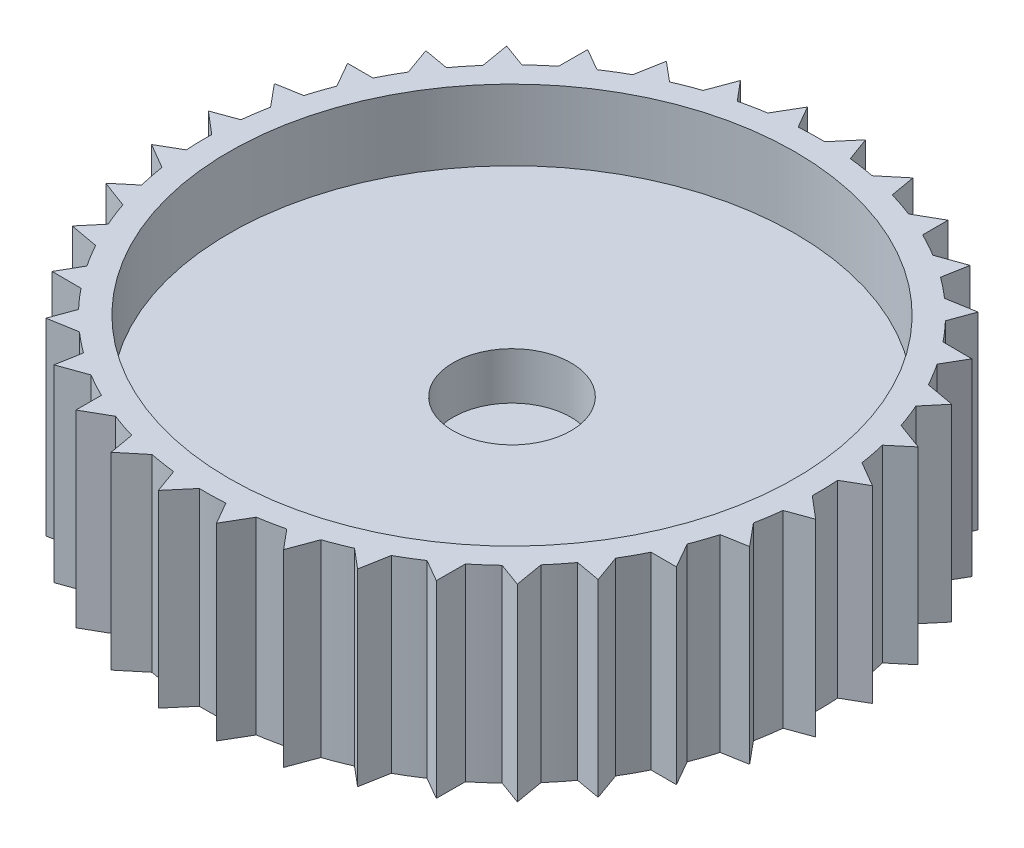
from build123d import *

# Parameters (mm, degrees)
SKETCH_1_R          = 13
EXTRUDE_1_DEPTH     = 8
SKETCH_2_R          = 12
CUT_EXTRUDE_1_DEPTH = 3
EXTRUDE_2_DEPTH     = 8
SKETCH_4_R          = 2.5
CUT_EXTRUDE_2_DEPTH = 2


with BuildPart() as part:
    # 草图1 → 凸台-拉伸1 (new body)
    with BuildSketch(Plane(origin=(0, 0, 0), x_dir=(1, 0, 0), z_dir=(0, 1, 0))):
        with Locations(Location((0, 0, 0), (0, 0, 270))):
            Circle(SKETCH_1_R)
    extrude(amount=EXTRUDE_1_DEPTH)

    # 草图2 → 切除-拉伸1 (cut)
    with BuildSketch(Plane(origin=(0, 8, 0), x_dir=(1, 0, 0), z_dir=(0, 1, 0))):
        with Locations(Location((0, 0, 0), (0, 0, 270))):
            Circle(SKETCH_2_R)
    extrude(amount=-CUT_EXTRUDE_1_DEPTH, mode=Mode.SUBTRACT)

    # 草图3 → 凸台-拉伸2 (add, through all)
    with BuildSketch(Plane(origin=(0, 8, 0), x_dir=(1, 0, 0), z_dir=(0, 1, 0))):
        Polygon((-12.123665589, 4.692199131), (-11.044603538, 4.692199131), (-11.653830585, 5.760922904), (-12.732892635, 5.760922904), align=None)
        Polygon((-11.124688039, 6.726166519), (-10.062019365, 6.53878936), (-10.476408948, 7.697067984), (-11.539077622, 7.884445143), align=None)
        Polygon((-9.787692472, 8.555762741), (-8.773705825, 8.186701784), (-8.980666927, 9.399341549), (-9.994653573, 9.768402506), align=None)
        Polygon((-8.153302822, 10.125396442), (-7.218807673, 9.585865416), (-7.212051886, 10.816020876), (-8.146547034, 11.355551902), align=None)
        Polygon((-6.271179191, 11.387375095), (-5.444569703, 10.693767379), (-5.224302297, 11.904060883), (-6.050911785, 12.597668599), align=None)
        Polygon((-4.198508954, 12.303354118), (-3.504901238, 11.47674463), (-3.077814927, 12.630402023), (-3.771422644, 13.457011511), align=None)
        Polygon((-1.998269147, 12.845501953), (-1.458738122, 11.911006804), (-0.837809708, 12.97297479), (-1.377340734, 13.907469938), align=None)
        Polygon((0.262687056, 12.99734571), (0.631748014, 11.983359064), (1.427651935, 12.921370282), (1.058590978, 13.935356928), align=None)
        Polygon((2.515661647, 12.754271695), (2.703038805, 11.691603022), (3.649735097, 12.477156476), (3.462357938, 13.53982515), align=None)
        Polygon((4.692199131, 12.123665589), (4.692199131, 11.044603538), (5.760922904, 11.653830585), (5.760922904, 12.732892635), align=None)
        Polygon((6.726166519, 11.124688039), (6.53878936, 10.062019365), (7.697067984, 10.476408948), (7.884445143, 11.539077622), align=None)
        Polygon((8.555762741, 9.787692472), (8.186701784, 8.773705825), (9.399341549, 8.980666927), (9.768402506, 9.994653573), align=None)
        Polygon((10.125396442, 8.153302822), (9.585865416, 7.218807673), (10.816020876, 7.212051886), (11.355551902, 8.146547034), align=None)
        Polygon((11.387375095, 6.271179191), (10.693767379, 5.444569703), (11.904060883, 5.224302297), (12.597668599, 6.050911785), align=None)
        Polygon((12.303354118, 4.198508954), (11.47674463, 3.504901238), (12.630402023, 3.077814927), (13.457011511, 3.771422644), align=None)
        Polygon((12.845501953, 1.998269147), (11.911006804, 1.458738122), (12.97297479, 0.837809708), (13.907469938, 1.377340734), align=None)
        Polygon((12.99734571, -0.262687056), (11.983359064, -0.631748014), (12.921370282, -1.427651935), (13.935356928, -1.058590978), align=None)
        Polygon((12.754271695, -2.515661647), (11.691603022, -2.703038805), (12.477156476, -3.649735097), (13.53982515, -3.462357938), align=None)
        Polygon((12.123665589, -4.692199131), (11.044603538, -4.692199131), (11.653830585, -5.760922904), (12.732892635, -5.760922904), align=None)
        Polygon((11.124688039, -6.726166519), (10.062019365, -6.53878936), (10.476408948, -7.697067984), (11.539077622, -7.884445143), align=None)
        Polygon((9.787692472, -8.555762741), (8.773705825, -8.186701784), (8.980666927, -9.399341549), (9.994653573, -9.768402506), align=None)
        Polygon((8.153302822, -10.125396442), (7.218807673, -9.585865416), (7.212051886, -10.816020876), (8.146547034, -11.355551902), align=None)
        Polygon((6.271179191, -11.387375095), (5.444569703, -10.693767379), (5.224302297, -11.904060883), (6.050911785, -12.597668599), align=None)
        Polygon((4.198508954, -12.303354118), (3.504901238, -11.47674463), (3.077814927, -12.630402023), (3.771422644, -13.457011511), align=None)
        Polygon((1.998269147, -12.845501953), (1.458738122, -11.911006804), (0.837809708, -12.97297479), (1.377340734, -13.907469938), align=None)
        Polygon((-0.262687056, -12.99734571), (-0.631748014, -11.983359064), (-1.427651935, -12.921370282), (-1.058590978, -13.935356928), align=None)
        Polygon((-2.515661647, -12.754271695), (-2.703038805, -11.691603022), (-3.649735097, -12.477156476), (-3.462357938, -13.53982515), align=None)
        Polygon((-4.692199131, -12.123665589), (-4.692199131, -11.044603538), (-5.760922904, -11.653830585), (-5.760922904, -12.732892635), align=None)
        Polygon((-6.726166519, -11.124688039), (-6.53878936, -10.062019365), (-7.697067984, -10.476408948), (-7.884445143, -11.539077622), align=None)
        Polygon((-8.555762741, -9.787692472), (-8.186701784, -8.773705825), (-9.399341549, -8.980666927), (-9.768402506, -9.994653573), align=None)
        Polygon((-10.125396442, -8.153302822), (-9.585865416, -7.218807673), (-10.816020876, -7.212051886), (-11.355551902, -8.146547034), align=None)
        Polygon((-11.387375095, -6.271179191), (-10.693767379, -5.444569703), (-11.904060883, -5.224302297), (-12.597668599, -6.050911785), align=None)
        Polygon((-12.303354118, -4.198508954), (-11.47674463, -3.504901238), (-12.630402023, -3.077814927), (-13.457011511, -3.771422644), align=None)
        Polygon((-12.845501953, -1.998269147), (-11.911006804, -1.458738122), (-12.97297479, -0.837809708), (-13.907469938, -1.377340734), align=None)
        Polygon((-12.99734571, 0.262687056), (-11.983359064, 0.631748014), (-12.921370282, 1.427651935), (-13.935356928, 1.058590978), align=None)
        Polygon((-12.754271695, 2.515661647), (-11.691603022, 2.703038805), (-12.477156476, 3.649735097), (-13.53982515, 3.462357938), align=None)
    extrude(amount=-EXTRUDE_2_DEPTH)

    # 草图4 → 切除-拉伸2 (cut)
    with BuildSketch(Plane(origin=(0, 5, 0), x_dir=(1, 0, 0), z_dir=(0, 1, 0))):
        with Locations(Location((0, 0, 0), (0, 0, 270))):
            Circle(SKETCH_4_R)
    extrude(amount=-CUT_EXTRUDE_2_DEPTH, mode=Mode.SUBTRACT)


solid = part.part
